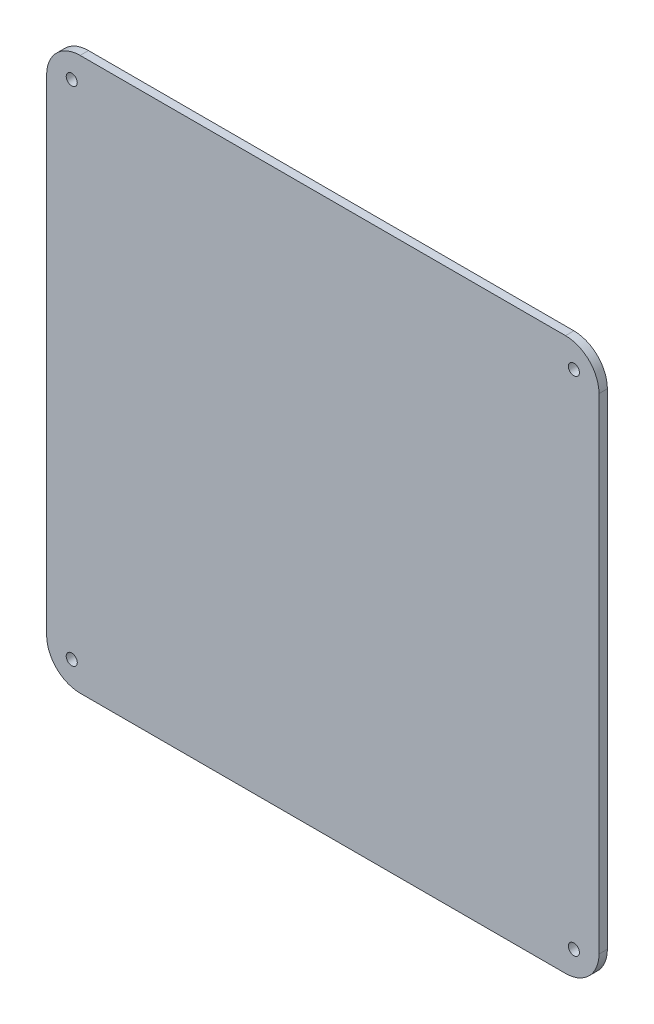
from build123d import *

# Parameters (mm, degrees)
SKETCH_1_W          = 330
SKETCH_1_H          = 330
EXTRUDE_1_DEPTH     = 5
FILLET_1_R          = 20
SKETCH_2_R          = 3.3
CUT_EXTRUDE_1_DEPTH = 10


with BuildPart() as part:
    # 草图1 → 凸台-拉伸1 (new body)
    with BuildSketch(Plane.XY):
        with Locations((121.871247651, 143.942488789)):
            Rectangle(SKETCH_1_W, SKETCH_1_H)
    extrude(amount=EXTRUDE_1_DEPTH)

    # 圆角1
    fillet_1_edges = [part.edges().sort_by_distance(p)[0] for p in [
        (-43.128752349, 308.942488789, 2.5),
        (286.871247651, 308.942488789, 2.5),
        (286.871247651, -21.057511211, 2.5),
        (-43.128752349, -21.057511211, 2.5),
    ]]
    fillet(fillet_1_edges, radius=FILLET_1_R)

    # 草图2 → 切除-拉伸1 (cut)
    with BuildSketch(Plane(origin=(0, 0, 0), x_dir=(-1, 0, 0), z_dir=(0, 0, -1))):
        with Locations((28.128752349, -6.057511211)):
            Circle(SKETCH_2_R)
        with Locations((-271.871247651, -6.057511211)):
            Circle(SKETCH_2_R)
        with Locations((-271.871247651, 293.942488789)):
            Circle(SKETCH_2_R)
        with Locations((28.128752349, 293.942488789)):
            Circle(SKETCH_2_R)
    extrude(amount=-CUT_EXTRUDE_1_DEPTH, mode=Mode.SUBTRACT)


solid = part.part
